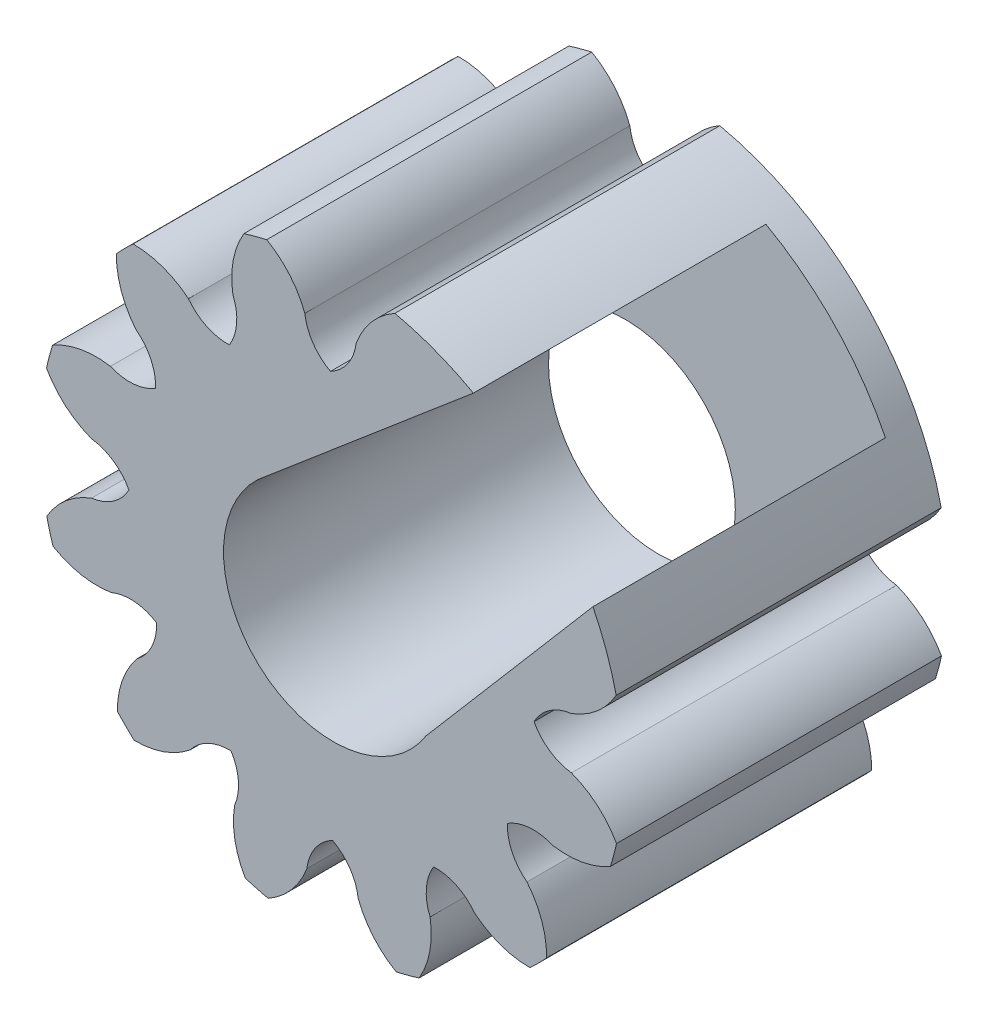
from build123d import *

# Parameters (mm, degrees)
SKETCH1_R           = 8.98338725
BOSS_EXTRUDE2_DEPTH = 10
CUT_EXTRUDE1_DEPTH  = 9
SKETCH9_R           = 3.37330117
CUT_EXTRUDE4_DEPTH  = 10
CUT_EXTRUDE5_DEPTH  = 10
CIRPATTERN2_COUNT   = 10
CIRPATTERN2_ANGLE   = 270


with BuildPart() as part:
    # Sketch1 → Boss-Extrude2 (new body)
    with BuildSketch(Plane.XY):
        Circle(SKETCH1_R)
    extrude(amount=-BOSS_EXTRUDE2_DEPTH)

    # Sketch2 → Cut-Extrude1 (cut)
    with BuildSketch(Plane.XY):
        with BuildLine():
            Line((-1.97475772, 2.477093755), (4.365982639, 7.851079039))
            ThreePointArc((4.365982639, 7.851079039), (6.497023817, 6.204025146), (8.044056542, 3.999300044))
            Line((8.044056542, 3.999300044), (2.911023025, -2.008935037))
            ThreePointArc((2.911023025, -2.008935037), (-2.230434429, -2.704958194), (-1.97475772, 2.477093755))
        make_face()
    extrude(amount=-CUT_EXTRUDE1_DEPTH, mode=Mode.SUBTRACT)

    # Sketch9 → Cut-Extrude4 (cut)
    with BuildSketch(Plane.XY):
        with Locations((0.051031531, -0.220189823)):
            Circle(SKETCH9_R)
    extrude(amount=-CUT_EXTRUDE4_DEPTH, mode=Mode.SUBTRACT)

    # Sketch10 → Cut-Extrude5 (cut)
    with BuildSketch(Plane.XY):
        with BuildLine():
            ThreePointArc((-0.030614018, 6.232538227), (0.505170096, 6.710825662), (0.759385982, 7.382538227))
            ThreePointArc((0.759385982, 7.382538227), (1.276411254, 8.232191257), (2.069385982, 8.832538227))
            ThreePointArc((2.069385982, 8.832538227), (-0.030614018, 8.990934274), (-2.130614018, 8.832538227))
            ThreePointArc((-2.130614018, 8.832538227), (-1.33763929, 8.232191257), (-0.820614018, 7.382538227))
            ThreePointArc((-0.820614018, 7.382538227), (-0.566398131, 6.710825662), (-0.030614018, 6.232538227))
        make_face()
    cut_extrude5 = extrude(amount=-CUT_EXTRUDE5_DEPTH, mode=Mode.SUBTRACT)

    # CirPattern2: Cut-Extrude5 ×10 about axis
    cirpattern2_axis = Axis((0, 0, 0), (0, 0, 1))
    for i in range(1, CIRPATTERN2_COUNT):
        add(cut_extrude5.rotate(cirpattern2_axis, i * CIRPATTERN2_ANGLE / (CIRPATTERN2_COUNT - 1)), mode=Mode.SUBTRACT)


solid = part.part
